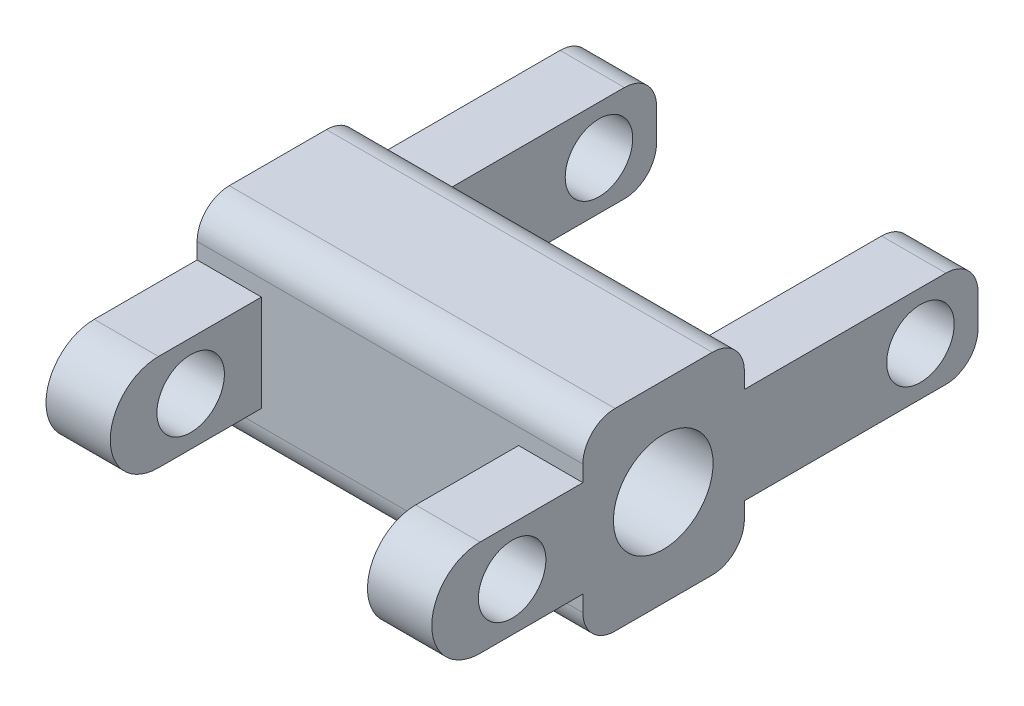
from build123d import *

# Parameters (mm, degrees)
EXTRUDE_1_DEPTH          = 3
SKETCH_2_OUTSIDE_W       = 13.724
SKETCH_2_OUTSIDE_H       = 8.024
CUT_EXTRUDE_1_DEPTH      = 12
SKETCH_3_R               = 1.05
CUT_EXTRUDE_2_DEPTH      = 12
SKETCH_4_R               = 0.95
EXTRUDE_2_DEPTH          = 4
EXTRUDE_3_DEPTH          = 8
SKETCH_6_R               = 1.05
CUT_EXTRUDE_3_DEPTH      = 12
SKETCH_8_W               = 8
SKETCH_8_H               = 7
CUT_EXTRUDE_4_DEPTH      = 8
EXTRUDE_5_DEPTH          = 2
SKETCH_12_W              = 8
SKETCH_12_H              = 3
EXTRUDE_8_DEPTH          = 4
SKETCH_14_W              = 12
SKETCH_14_H              = 3
EXTRUDE_9_DEPTH          = 5
SKETCH_16_R              = 0.6
CUT_EXTRUDE_5_DEPTH      = 4
SKETCH_15_R              = 0.85
CUT_EXTRUDE_6_DEPTH      = 4
EXTRUDE_START            = 1.5
SKETCH_18_W              = 12
SKETCH_18_H              = 5.023607379
EXTRUDE_11_DEPTH         = 6
SKETCH_19_R              = 1.55
CUT_EXTRUDE_7_DEPTH      = 19.553975315
FILLET_1_R               = 1
CUT_EXTRUDE_8_DEPTH      = 19.553975315
CUT_EXTRUDE_8_DEPTH_BACK = 19.553975315
SKETCH_11_R              = 1.05
CUT_EXTRUDE_9_DEPTH      = 19.553975315
FILLET_2_R               = 1
SKETCH_21_W              = 8
SKETCH_21_H              = 2.221688244
CUT_EXTRUDE_10_DEPTH     = 12.939765268


with BuildPart() as part:
    # 草图1 → 凸台-拉伸1 (new body)
    with BuildSketch(Plane(origin=(0, 0, 0), x_dir=(1, 0, 0), z_dir=(0, 1, 0))):
        Polygon((-6, 0), (6, 0), (6, -8.7), (4, -8.7), (4, -3), (-4, -3), (-4, -8.7), (-6, -8.7), align=None)
    extrude(amount=EXTRUDE_1_DEPTH)

    # 草图2 outside → 切除-拉伸1 (cut)
    with BuildSketch(Plane.ZY.offset(6)):
        with Locations((4.35, 1.5)):
            Rectangle(SKETCH_2_OUTSIDE_W, SKETCH_2_OUTSIDE_H)
        with BuildLine():
            Line((6.2, 3), (0, 3))
            Line((0, 3), (0, 0))
            Line((0, 0), (6.2, 0))
            ThreePointArc((6.2, 0), (7.7, 1.5), (6.2, 3))
        make_face(mode=Mode.SUBTRACT)
    extrude(amount=-CUT_EXTRUDE_1_DEPTH, mode=Mode.SUBTRACT)

    # 草图3 → 切除-拉伸2 (cut)
    with BuildSketch(Plane.ZY.offset(6)):
        with Locations((5.2, 1.5)):
            Circle(SKETCH_3_R)
    extrude(amount=-CUT_EXTRUDE_2_DEPTH, mode=Mode.SUBTRACT)

    # 草图4 → 凸台-拉伸2 (add)
    with BuildSketch(Plane(origin=(0, 0, 0), x_dir=(-1, 0, 0), z_dir=(0, 0, -1))):
        with Locations((0, 1.5)):
            Circle(SKETCH_4_R)
    extrude(amount=EXTRUDE_2_DEPTH)

    # 草图5 → 凸台-拉伸3 (add)
    with BuildSketch(Plane(origin=(0, 0, -4), x_dir=(-1, 0, 0), z_dir=(0, 0, -1))):
        Polygon((-5, 3), (-6, 3), (-6, 0), (-4, 0), (4, 0), (6, 0), (6, 3), (5, 3), align=None)
    extrude(amount=EXTRUDE_3_DEPTH)

    # 草图6 → 切除-拉伸3 (cut)
    with BuildSketch(Plane(origin=(6, 0, 0), x_dir=(0, 0, -1), z_dir=(1, 0, 0))):
        with Locations((7.5, 1.5)):
            Circle(SKETCH_6_R)
    extrude(amount=-CUT_EXTRUDE_3_DEPTH, mode=Mode.SUBTRACT)

    # 草图8 → 切除-拉伸4 (cut)
    with BuildSketch(Plane(origin=(0, 3, 0), x_dir=(1, 0, 0), z_dir=(0, 1, 0))):
        with Locations((0, 8.5)):
            Rectangle(SKETCH_8_W, SKETCH_8_H)
    extrude(amount=-CUT_EXTRUDE_4_DEPTH, mode=Mode.SUBTRACT)

    # 草图10 → 凸台-拉伸5 (add)
    with BuildSketch(Plane.ZY.offset(6)):
        with BuildLine():
            Line((-12, 3), (-12, 5.5))
            ThreePointArc((-12, 5.5), (-10, 7.5), (-8, 5.5))
            Line((-8, 5.5), (-8, 3))
            Line((-8, 3), (-12, 3))
        make_face()
    extrude_5 = extrude(amount=-EXTRUDE_5_DEPTH)

    # 镜向1: 凸台-拉伸5 across plane
    add(extrude_5.mirror(Plane(origin=(0, 0, 0), x_dir=(0, 0, 1), z_dir=(1, 0, 0))))

    # 草图12 → 凸台-拉伸8 (add)
    with BuildSketch(Plane.XY.offset(-4)):
        with Locations((0, 1.5)):
            Rectangle(SKETCH_12_W, SKETCH_12_H)
    extrude(amount=EXTRUDE_8_DEPTH)

    # 草图14 → 凸台-拉伸9 (add)
    with BuildSketch(Plane(origin=(0, 0, 0), x_dir=(-1, 0, 0), z_dir=(0, 0, -1))):
        with Locations((0, 1.5)):
            Rectangle(SKETCH_14_W, SKETCH_14_H)
    extrude(amount=EXTRUDE_9_DEPTH)

    # 草图16 → 切除-拉伸5 (cut)
    with BuildSketch(Plane.ZY.offset(6)):
        with Locations((1.2, 1.5)):
            Circle(SKETCH_16_R)
    extrude(amount=-CUT_EXTRUDE_5_DEPTH, mode=Mode.SUBTRACT)

    # 草图15 → 切除-拉伸6 (cut)
    with BuildSketch(Plane(origin=(6, 0, 0), x_dir=(0, 0, -1), z_dir=(1, 0, 0))):
        with Locations((-1.2, 1.5)):
            Circle(SKETCH_15_R)
    extrude(amount=-CUT_EXTRUDE_6_DEPTH, mode=Mode.SUBTRACT)

    # 草图18 → 凸台-拉伸11 (add)
    with BuildSketch(Plane(origin=(0, 3, 0), x_dir=(1, 0, 0), z_dir=(0, 1, 0)).offset(EXTRUDE_START)):
        with Locations((0, -0.488196311)):
            Rectangle(SKETCH_18_W, SKETCH_18_H)
    extrude(amount=-EXTRUDE_11_DEPTH)

    # 草图19 → 切除-拉伸7 (cut, through all)
    with BuildSketch(Plane(origin=(6, 0, 0), x_dir=(0, 0, -1), z_dir=(1, 0, 0))):
        with Locations((-0.5, 1.5)):
            Circle(SKETCH_19_R)
    extrude(amount=-CUT_EXTRUDE_7_DEPTH, mode=Mode.SUBTRACT)

    # 圆角1
    fillet_1_edges = [part.edges().sort_by_distance(p)[0] for p in [
        (0, -1.5, -2.023607379),
        (0, -1.5, 3),
        (0, 4.5, 3),
        (0, 4.5, -2.023607379),
    ]]
    fillet(fillet_1_edges, radius=FILLET_1_R)

    # 草图11 → 切除-拉伸8 (cut, two sides: drawn at the far end of the back side and taken through both)
    with BuildSketch(Plane.ZY.offset(6).offset(-CUT_EXTRUDE_8_DEPTH_BACK)):
        with Locations((-10, 5.5)):
            Circle(SKETCH_11_R)
    extrude(amount=CUT_EXTRUDE_8_DEPTH + CUT_EXTRUDE_8_DEPTH_BACK, mode=Mode.SUBTRACT)

    # 草图20 → 切除-拉伸9 (cut, through all)
    with BuildSketch(Plane(origin=(6, 0, 0), x_dir=(0, 0, -1), z_dir=(1, 0, 0))):
        Polygon((8, 3), (9.290209613, 3), (9.290209613, 0), (12, 0), (12, 7.886253168), (8, 7.886253168), align=None)
    extrude(amount=-CUT_EXTRUDE_9_DEPTH, mode=Mode.SUBTRACT)

    # 圆角2
    fillet_2_edges = [part.edges().sort_by_distance(p)[0] for p in [
        (5, 0, -9.290209613),
        (-5, 0, -9.290209613),
        (5, 3, -9.290209613),
        (-5, 3, -9.290209613),
    ]]
    fillet(fillet_2_edges, radius=FILLET_2_R)

    # 草图21 → 切除-拉伸10 (cut, through all)
    with BuildSketch(Plane(origin=(0, 3, 0), x_dir=(1, 0, 0), z_dir=(0, 1, 0))):
        with Locations((0, 3.889155878)):
            Rectangle(SKETCH_21_W, SKETCH_21_H)
    extrude(amount=-CUT_EXTRUDE_10_DEPTH, mode=Mode.SUBTRACT)


solid = part.part
